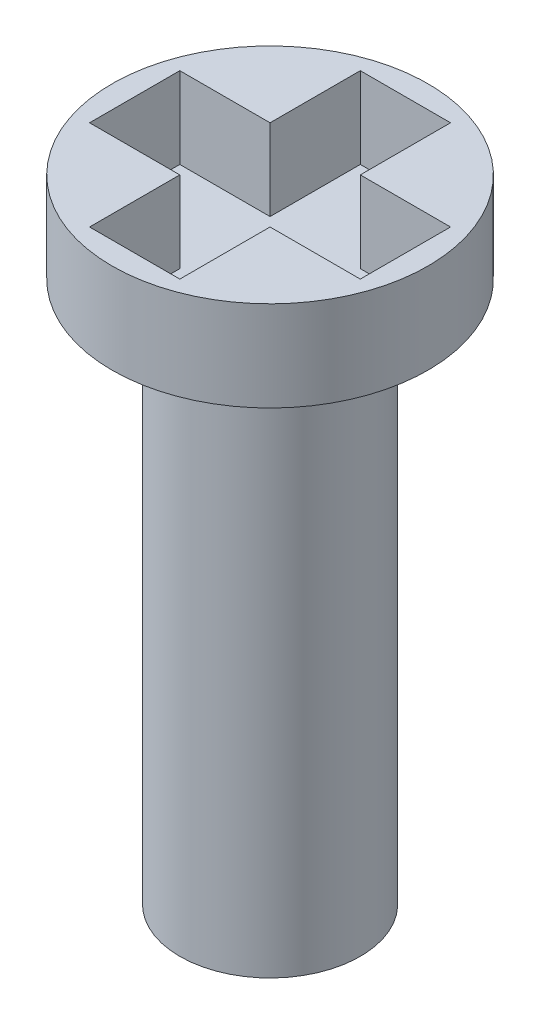
from build123d import *

# Parameters (mm, degrees)
SKETCH1_R           = 1.75
BOSS_EXTRUDE1_DEPTH = 1
SKETCH2_R           = 1.75
BOSS_EXTRUDE2_DEPTH = 0.1
SKETCH3_R           = 1
BOSS_EXTRUDE3_DEPTH = 6


with BuildPart() as part:
    # Sketch1 → Boss-Extrude1 (new body)
    with BuildSketch(Plane(origin=(0, 0, 0), x_dir=(1, 0, 0), z_dir=(0, 1, 0))):
        with Locations(Location((0, 0, 0), (0, 0, 270))):
            Circle(SKETCH1_R)
        Polygon((-0.5, -0.5), (-1.5, -0.5), (-1.5, 0.5), (-0.5, 0.5), (-0.5, 1.5), (0.5, 1.5), (0.5, 0.5), (1.5, 0.5), (1.5, -0.5), (0.5, -0.5), (0.5, -1.5), (-0.5, -1.5), align=None, mode=Mode.SUBTRACT)
    extrude(amount=BOSS_EXTRUDE1_DEPTH)

    # Sketch2 → Boss-Extrude2 (add)
    with BuildSketch(Plane.XZ):
        with Locations(Location((0, 0, 0), (0, 0, 90))):
            Circle(SKETCH2_R)
    extrude(amount=-BOSS_EXTRUDE2_DEPTH)

    # Sketch3 → Boss-Extrude3 (add)
    with BuildSketch(Plane.XZ):
        with Locations(Location((0, 0, 0), (0, 0, 270))):
            Circle(SKETCH3_R)
    extrude(amount=BOSS_EXTRUDE3_DEPTH)


solid = part.part
